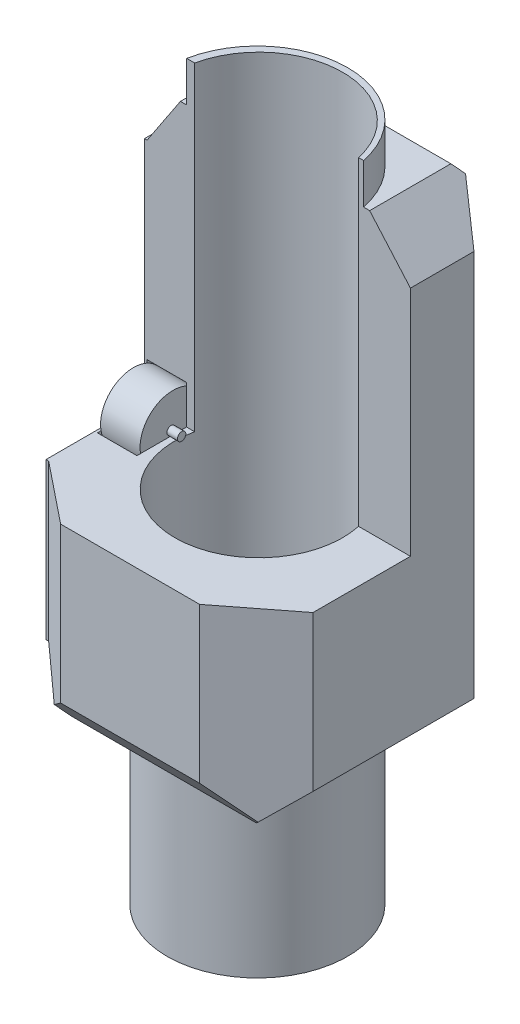
from build123d import *

# Parameters (mm, degrees)
SKETCH1_W           = 100
SKETCH1_H           = 100
BOSS_EXTRUDE1_DEPTH = 180
SKETCH2_R           = 34.257790197
BOSS_EXTRUDE2_DEPTH = 350
SKETCH3_W           = 152.006357392
SKETCH3_H           = 282.452416457
CUT_EXTRUDE2_DEPTH  = 400
CUT_EXTRUDE3_DEPTH  = 400
CUT_EXTRUDE4_DEPTH  = 400
CUT_EXTRUDE5_DEPTH  = 400
SKETCH7_W           = 160.159381639
SKETCH7_H           = 147.362276113
CUT_EXTRUDE6_DEPTH  = 400
SKETCH8_W           = 147.310744502
SKETCH8_H           = 162.038906966
CUT_EXTRUDE7_DEPTH  = 400
SKETCH9_R           = 31.847293423
CUT_EXTRUDE8_DEPTH  = 400
SKETCH10_W          = 140.220962397
SKETCH10_H          = 212.033531124
CUT_EXTRUDE9_DEPTH  = 400
SKETCH11_R          = 13.603137886
CUT_EXTRUDE11_DEPTH = 15
SKETCH12_R          = 12.495422516
BOSS_EXTRUDE3_DEPTH = 15
SKETCH13_R          = 1.594865099
BOSS_EXTRUDE4_DEPTH = 4
SKETCH14_W          = 100.74862993
SKETCH14_H          = 110.555003588
CUT_EXTRUDE13_DEPTH = 400
BOSS_EXTRUDE5_DEPTH = 1
SKETCH16_W          = 42.108585165
SKETCH16_H          = 30.458347221
BOSS_EXTRUDE6_DEPTH = 5


with BuildPart() as part:
    # Sketch1 → Boss-Extrude1 (new body)
    with BuildSketch(Plane(origin=(0, 0, 0), x_dir=(1, 0, 0), z_dir=(0, 1, 0))):
        with Locations((-50, 50)):
            Rectangle(SKETCH1_W, SKETCH1_H)
    extrude(amount=BOSS_EXTRUDE1_DEPTH)

    # Sketch2 → Boss-Extrude2 (add, symmetric)
    with BuildSketch(Plane(origin=(0, 180, 0), x_dir=(1, 0, 0), z_dir=(0, 1, 0))):
        with Locations(Location((-51.377291833, 49.076536384, 0), (0, 0, 270))):
            Circle(SKETCH2_R)
    extrude(amount=BOSS_EXTRUDE2_DEPTH, both=True)

    # Sketch3 → Cut-Extrude2 (cut)
    with BuildSketch(Plane(origin=(0, 0, 0), x_dir=(0, 0, -1), z_dir=(1, 0, 0))):
        with Locations((57.419900112, 502.274302507)):
            Rectangle(SKETCH3_W, SKETCH3_H)
    extrude(amount=-CUT_EXTRUDE2_DEPTH, mode=Mode.SUBTRACT)

    # Sketch4 → Cut-Extrude3 (cut)
    with BuildSketch(Plane(origin=(0, 0, 0), x_dir=(0, 0, -1), z_dir=(1, 0, 0))):
        Polygon((12.981970869, 0), (-8.994244796, 25.828096003), (-18.564506014, -15.259465835), align=None)
        Polygon((85.072517936, -1.448103984), (109.237639161, 19.113145112), (115.920034239, -3.267382694), align=None)
        Polygon((12.981970869, 180), (-8.994244796, 148.537596011), (-15.418178585, 193.219274892), align=None)
        Polygon((85.072517936, 181.854312784), (103.841225373, 159.795920888), (106.132549481, 198.647393934), align=None)
    extrude(amount=-CUT_EXTRUDE3_DEPTH, mode=Mode.SUBTRACT)

    # Sketch5 → Cut-Extrude4 (cut)
    with BuildSketch(Plane.XY):
        Polygon((-85.623287335, 0), (-106.370377984, 21.426392531), (-122.288861874, 3.209259887), (-93.526345261, -19.884701759), align=None)
        Polygon((-15.694988751, 0), (0, 15.257385304), (12.122677088, 15.257385304), (10.563067769, -19.884701759), align=None)
        Polygon((-87.166490339, 180.248071029), (-106.370377984, 151.29108453), (-117.705469457, 200.501115102), align=None)
        Polygon((-15.694988751, 180.248071029), (7.833767065, 153.279557508), (0, 193.941208308), align=None)
    extrude(amount=-CUT_EXTRUDE4_DEPTH, mode=Mode.SUBTRACT)

    # Sketch6 → Cut-Extrude5 (cut)
    with BuildSketch(Plane(origin=(0, 180, 0), x_dir=(1, 0, 0), z_dir=(0, 1, 0))):
        Polygon((-112.386997555, 28.400400964), (-64.261264503, -10.212759359), (-84.406366528, -15.51192827), (-124.649689542, -15.51192827), align=None)
        Polygon((-97.065537028, 135.861756084), (-119.37552445, 77.792688888), (-118.043343626, 64.347606737), (-66.428694172, 110.575168787), align=None)
        Polygon((-24.69640689, -21.815840769), (11.092108798, -8.97361337), (17.428316417, 32.393768119), (-38.531576846, -11.139157378), align=None)
        Polygon((-17.445484601, 140.804394854), (35.417473102, 107.262520599), (9.305452855, 72.996438725), (-31.724385352, 103.625272537), align=None)
    extrude(amount=-CUT_EXTRUDE5_DEPTH, mode=Mode.SUBTRACT)

    # Sketch7 → Cut-Extrude6 (cut)
    with BuildSketch(Plane.XY):
        with Locations((-66.123258915, -136.36252694)):
            Rectangle(SKETCH7_W, SKETCH7_H)
    extrude(amount=-CUT_EXTRUDE6_DEPTH, mode=Mode.SUBTRACT)

    # Sketch8 → Cut-Extrude7 (cut)
    with BuildSketch(Plane.XY):
        with Locations((-53.541153336, 332.448287589)):
            Rectangle(SKETCH8_W, SKETCH8_H)
    extrude(amount=-CUT_EXTRUDE7_DEPTH, mode=Mode.SUBTRACT)

    # Sketch9 → Cut-Extrude8 (cut)
    with BuildSketch(Plane(origin=(0, 251.428834106, 0), x_dir=(1, 0, 0), z_dir=(0, 1, 0))):
        with Locations(Location((-50.808993157, 49.032036374, 0), (0, 0, 270))):
            Circle(SKETCH9_R)
    extrude(amount=-CUT_EXTRUDE8_DEPTH, mode=Mode.SUBTRACT)

    # Sketch10 → Cut-Extrude9 (cut)
    with BuildSketch(Plane.ZY.offset(100)):
        with Locations((14.299084536, 180.100625535)):
            Rectangle(SKETCH10_W, SKETCH10_H)
    extrude(amount=-CUT_EXTRUDE9_DEPTH, mode=Mode.SUBTRACT)

    # Sketch11 → Cut-Extrude11 (cut)
    with BuildSketch(Plane.ZY.offset(100)):
        with Locations((-50.413251954, 76.264646142)):
            Circle(SKETCH11_R)
    extrude(amount=-CUT_EXTRUDE11_DEPTH, mode=Mode.SUBTRACT)

    # Sketch12 → Boss-Extrude3 (add)
    with BuildSketch(Plane.ZY.offset(85)):
        with Locations(Location((-50.658800768, 76.222522328, 0), (0, 0, 114.353089558))):
            Circle(SKETCH12_R)
    extrude(amount=BOSS_EXTRUDE3_DEPTH)

    # Sketch13 → Boss-Extrude4 (add)
    with BuildSketch(Plane(origin=(-85, 0, 0), x_dir=(0, 0, -1), z_dir=(1, 0, 0))):
        with Locations(Location((49.945205578, 75.944780088, 0), (0, 0, 180))):
            Circle(SKETCH13_R)
    extrude(amount=BOSS_EXTRUDE4_DEPTH)

    # Sketch14 → Cut-Extrude13 (cut)
    with BuildSketch(Plane.ZY.offset(100)):
        with Locations((-65.350029467, 250.603414818)):
            Rectangle(SKETCH14_W, SKETCH14_H)
    extrude(amount=-CUT_EXTRUDE13_DEPTH, mode=Mode.SUBTRACT)

    # Sketch15 → Boss-Extrude5 (add)
    with BuildSketch(Plane.ZY.offset(100)):
        Polygon((-18.461827727, 14.847435435), (-80.507743362, 14.847435435), (-80.507743362, 160.896793159), (-55.811396663, 160.896793159), (-55.811396663, 74.083859973), (-18.461827727, 74.083859973), align=None)
    extrude(amount=BOSS_EXTRUDE5_DEPTH)

    # Sketch16 → Boss-Extrude6 (add)
    with BuildSketch(Plane.ZY.offset(101)):
        with Locations((-48.07732297, 45.136437142)):
            Rectangle(SKETCH16_W, SKETCH16_H)
    extrude(amount=BOSS_EXTRUDE6_DEPTH)


solid = part.part
